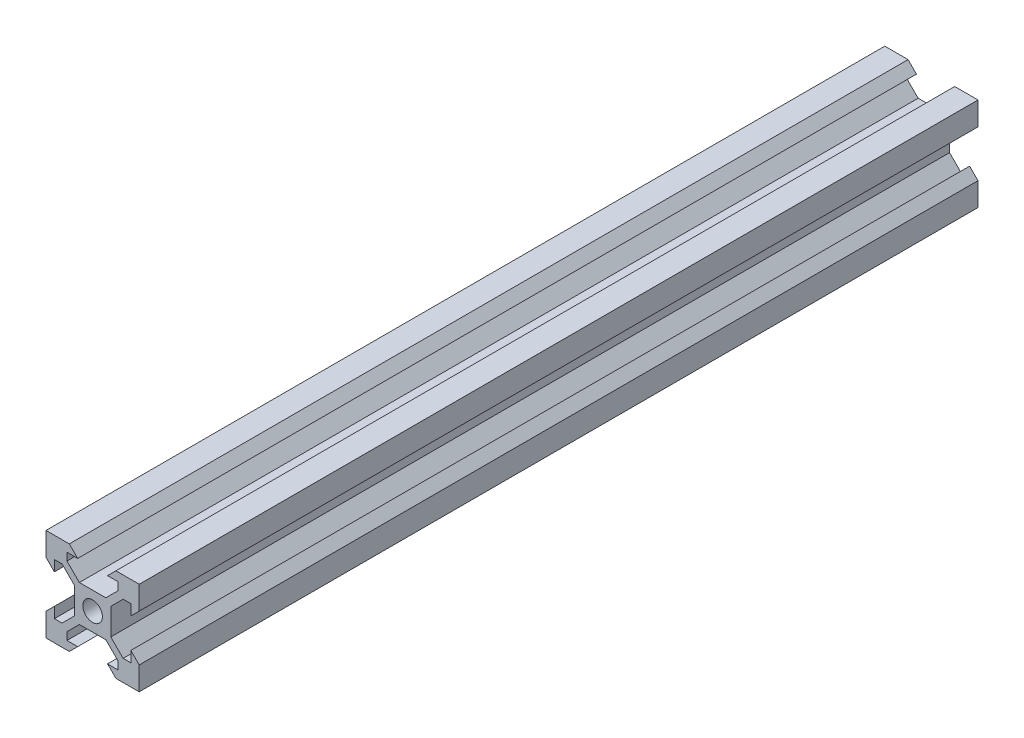
from build123d import *

# Parameters (mm, degrees)
SKETCH1_R           = 2.1
BOSS_EXTRUDE1_DEPTH = 180


with BuildPart() as part:
    # Sketch1 → Boss-Extrude1 (new body)
    with BuildSketch(Plane.XY):
        Polygon((-10, 10), (-10, 5), (-8.2, 3.2), (-8.2, 5.499339828), (-6.56, 5.499339828), (-3.900660172, 2.84), (-3.900660172, -2.84), (-6.56, -5.499339828), (-8.2, -5.499339828), (-8.2, -3.2), (-10, -5), (-10, -10), (-5, -10), (-3.2, -8.2), (-5.499339828, -8.2), (-5.499339828, -6.56), (-2.84, -3.900660172), (2.84, -3.900660172), (5.499339828, -6.56), (5.499339828, -8.2), (3.2, -8.2), (5, -10), (10, -10), (10, -5), (8.2, -3.2), (8.2, -5.499339828), (6.56, -5.499339828), (3.900660172, -2.84), (3.900660172, 2.84), (6.56, 5.499339828), (8.2, 5.499339828), (8.2, 3.2), (10, 5), (10, 10), (5, 10), (3.2, 8.2), (5.499339828, 8.2), (5.499339828, 6.56), (2.84, 3.900660172), (-2.84, 3.900660172), (-5.499339828, 6.56), (-5.499339828, 8.2), (-3.2, 8.2), (-5, 10), align=None)
        Circle(SKETCH1_R, mode=Mode.SUBTRACT)
    extrude(amount=-BOSS_EXTRUDE1_DEPTH)


solid = part.part
